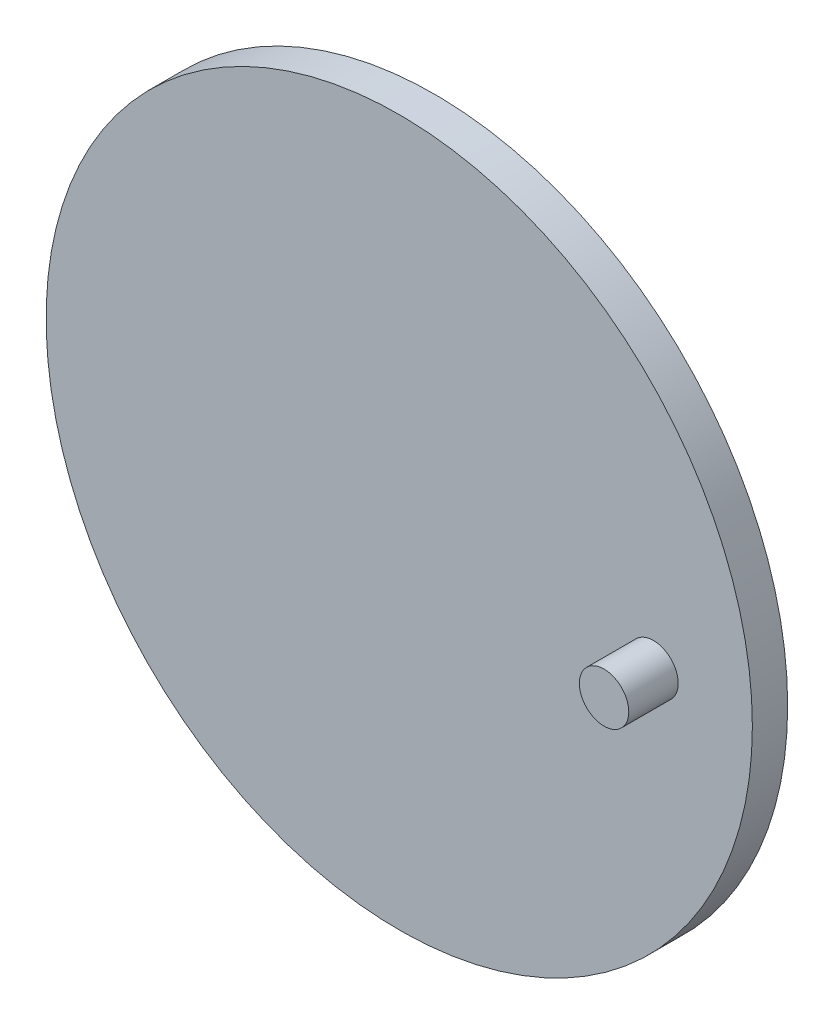
from build123d import *

# Parameters (mm, degrees)
SKETCH1_R           = 63.5
BOSS_EXTRUDE1_DEPTH = 6.35
SKETCH2_R           = 4.445
BOSS_EXTRUDE2_DEPTH = 8.89
SKETCH1_3_R         = 4.445
BOSS_EXTRUDE3_DEPTH = 6.35
SKETCH3_R           = 7.665246074
BOSS_EXTRUDE4_DEPTH = 2.54


with BuildPart() as part:
    # Sketch1 → Boss-Extrude1 (new body)
    with BuildSketch(Plane.XY):
        Circle(SKETCH1_R)
    extrude(amount=BOSS_EXTRUDE1_DEPTH)

    # Sketch2 → Boss-Extrude2 (add)
    with BuildSketch(Plane.XY.offset(6.35)):
        with Locations((45.72, 0)):
            Circle(SKETCH2_R)
    extrude(amount=BOSS_EXTRUDE2_DEPTH)

    # Sketch1<3> → Boss-Extrude3 (add)
    with BuildSketch(Plane.XY):
        Circle(SKETCH1_3_R)
    extrude(amount=-BOSS_EXTRUDE3_DEPTH)

    # Sketch3 → Boss-Extrude4 (add)
    with BuildSketch(Plane(origin=(0, 0, -6.35), x_dir=(-1, 0, 0), z_dir=(0, 0, -1))):
        Circle(SKETCH3_R)
    extrude(amount=BOSS_EXTRUDE4_DEPTH)


solid = part.part
